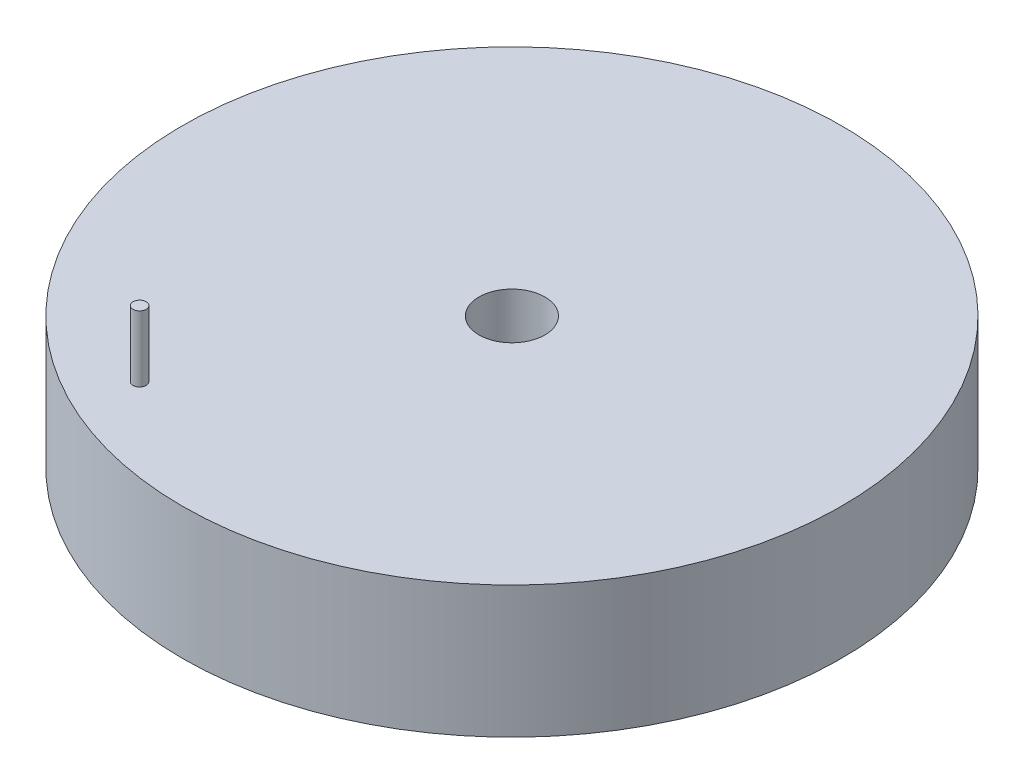
from build123d import *

# Parameters (mm, degrees)
SKETCH1_R           = 50
BOSS_EXTRUDE1_DEPTH = 20
SKETCH4_R           = 5
CUT_EXTRUDE2_DEPTH  = 20
SKETCH5_R           = 1
BOSS_EXTRUDE2_DEPTH = 10


with BuildPart() as part:
    # Sketch1 → Boss-Extrude1 (new body)
    with BuildSketch(Plane(origin=(0, 0, 0), x_dir=(1, 0, 0), z_dir=(0, 1, 0))):
        with Locations(Location((0, 0, 0), (0, 0, 270))):
            Circle(SKETCH1_R)
    extrude(amount=BOSS_EXTRUDE1_DEPTH)

    # Sketch4 → Cut-Extrude2 (cut)
    with BuildSketch(Plane.XZ):
        with Locations(Location((0, 0, 0), (0, 0, 270))):
            Circle(SKETCH4_R)
    extrude(amount=-CUT_EXTRUDE2_DEPTH, mode=Mode.SUBTRACT)

    # Sketch5 → Boss-Extrude2 (add)
    with BuildSketch(Plane(origin=(0, 20, 0), x_dir=(1, 0, 0), z_dir=(0, 1, 0))):
        with Locations(Location((-19.611481927, -36.877253926, 0), (0, 0, 270))):
            Circle(SKETCH5_R)
    extrude(amount=BOSS_EXTRUDE2_DEPTH)


solid = part.part
